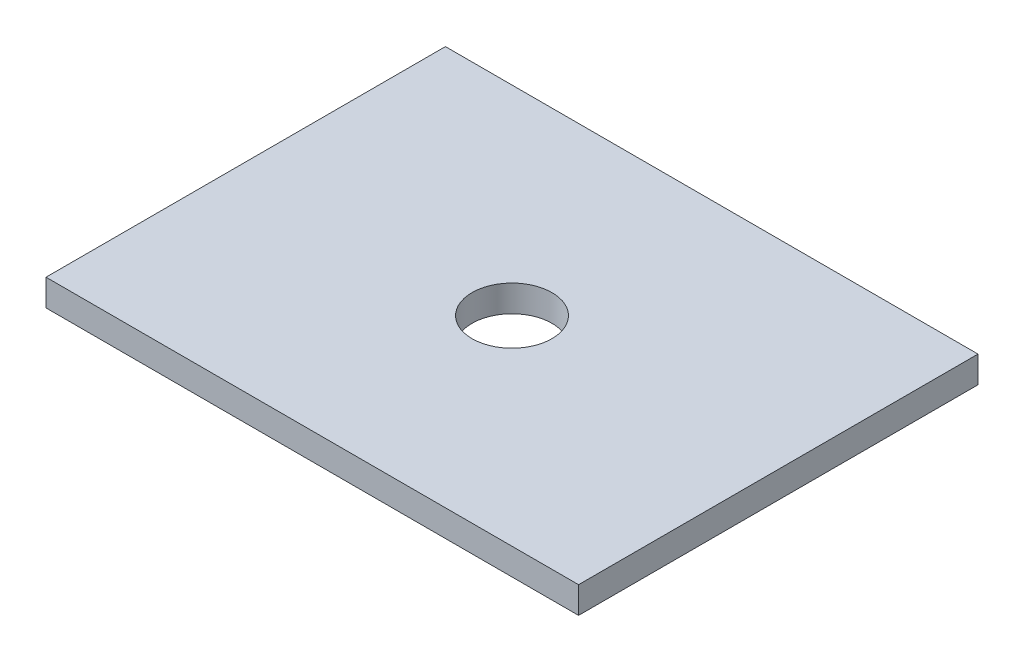
from build123d import *

# Parameters (mm, degrees)
SKETCH1_W           = 40
SKETCH1_H           = 30
BOSS_EXTRUDE1_DEPTH = 2
SKETCH2_R           = 3
CUT_EXTRUDE1_DEPTH  = 2


with BuildPart() as part:
    # Sketch1 → Boss-Extrude1 (new body)
    with BuildSketch(Plane(origin=(0, 0, 0), x_dir=(1, 0, 0), z_dir=(0, 1, 0))):
        Rectangle(SKETCH1_W, SKETCH1_H)
    extrude(amount=BOSS_EXTRUDE1_DEPTH)

    # Sketch2 → Cut-Extrude1 (cut)
    with BuildSketch(Plane(origin=(0, 2, 0), x_dir=(1, 0, 0), z_dir=(0, 1, 0))):
        with Locations(Location((0, 0, 0), (0, 0, 270))):
            Circle(SKETCH2_R)
    extrude(amount=-CUT_EXTRUDE1_DEPTH, mode=Mode.SUBTRACT)


solid = part.part
